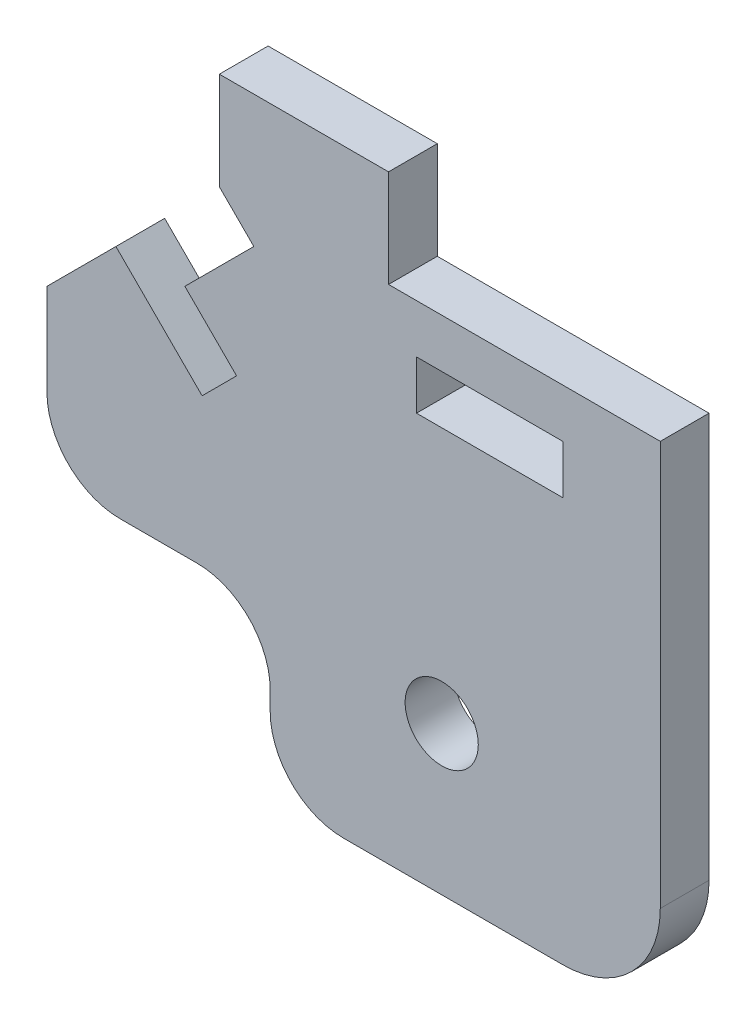
from build123d import *

# Parameters (mm, degrees)
MODEL_R             = 1.5
MODEL_W             = 6
MODEL_H             = 2
BOSS_EXTRUDE1_DEPTH = 2


with BuildPart() as part:
    # Model → Boss-Extrude1 (new body)
    with BuildSketch(Plane.XY):
        with BuildLine():
            Line((1964.402734505, 1171.526635788), (1960.867200599, 1175.062169694))
            Line((1960.867200599, 1175.062169694), (1958.038773475, 1172.23374257))
            Line((1958.038773475, 1172.23374257), (1958.038773475, 1168.476383257))
            ThreePointArc((1958.038773475, 1168.476383257), (1958.917453131, 1166.355062913), (1961.038773475, 1165.476383257))
            Line((1961.038773475, 1165.476383257), (1963.867200599, 1165.476383257))
            Line((1963.867200599, 1165.476383257), (1964.195627724, 1165.476383257))
            ThreePointArc((1964.195627724, 1165.476383257), (1966.316948068, 1164.5977036), (1967.195627724, 1162.476383257))
            Line((1967.195627724, 1162.476383257), (1967.195627724, 1161.713700328))
            ThreePointArc((1967.195627724, 1161.713700328), (1968.074307381, 1159.592379984), (1970.195627724, 1158.713700328))
            Line((1970.195627724, 1158.713700328), (1979.195627724, 1158.713700328))
            ThreePointArc((1979.195627724, 1158.713700328), (1982.024054849, 1159.885273203), (1983.195627724, 1162.713700328))
            Line((1983.195627724, 1162.713700328), (1983.195627724, 1179.304810381))
            Line((1983.195627724, 1179.304810381), (1972.049181115, 1179.304810381))
            Line((1972.049181115, 1179.304810381), (1972.049181115, 1183.304810381))
            Line((1972.049181115, 1183.304810381), (1965.109841287, 1183.304810381))
            Line((1965.109841287, 1183.304810381), (1965.109841287, 1179.304810381))
            Line((1965.109841287, 1179.304810381), (1966.524054849, 1177.890596819))
            Line((1966.524054849, 1177.890596819), (1963.695627724, 1175.062169694))
            Line((1963.695627724, 1175.062169694), (1965.816948068, 1172.940849351))
            Line((1965.816948068, 1172.940849351), (1964.402734505, 1171.526635788))
        make_face()
        with Locations((1974.230460889, 1164.796116562)):
            Circle(MODEL_R, mode=Mode.SUBTRACT)
        with Locations((1976.195627724, 1176.304810381)):
            Rectangle(MODEL_W, MODEL_H, mode=Mode.SUBTRACT)
    extrude(amount=BOSS_EXTRUDE1_DEPTH)


solid = part.part
